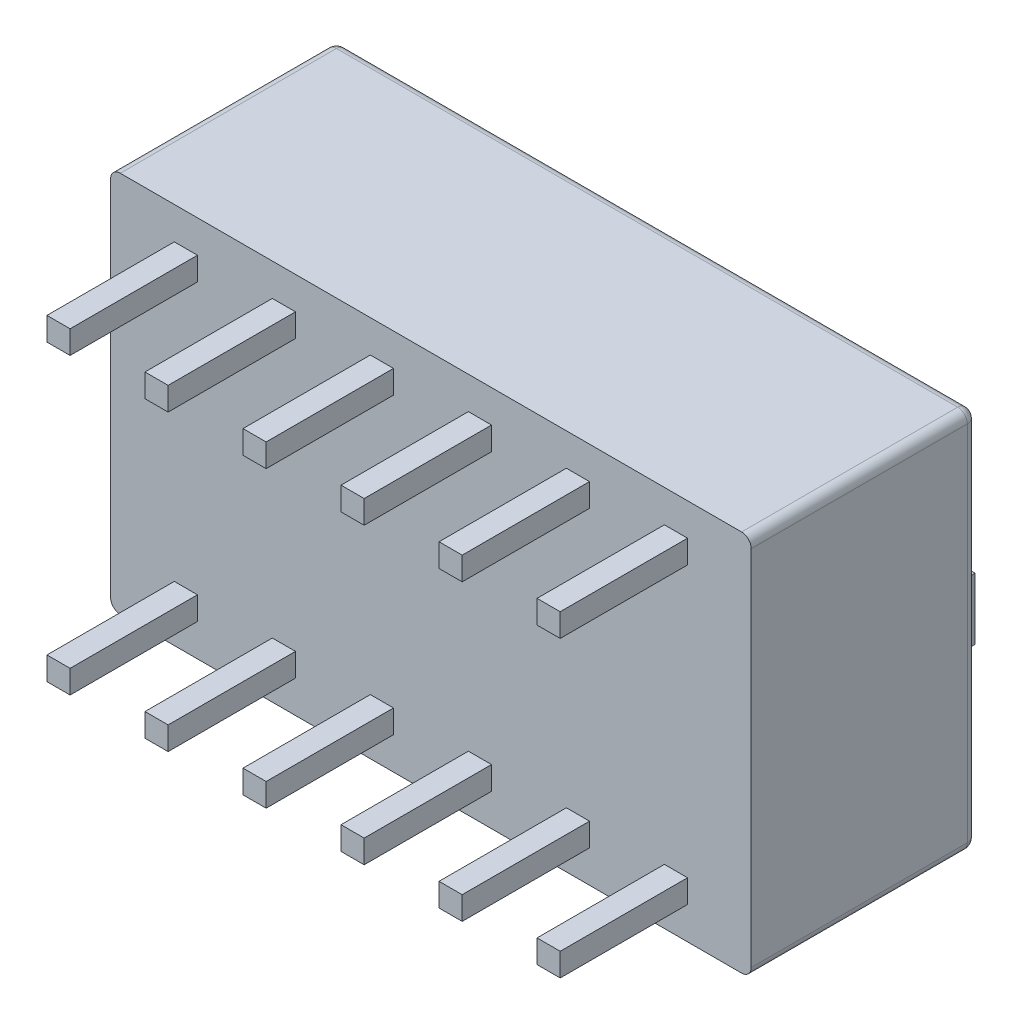
from build123d import *

# Parameters (mm, degrees)
IZIM1_W                       = 16.6
IZIM1_H                       = 9.9
Y_KSEKLIK_EKSTR_ZYON1_DEPTH   = 5.85
IZIM2_W                       = 1.4
IZIM2_H                       = 3.2
KES_EKSTR_ZYON1_DEPTH         = 1
IZIM3_W                       = 1.4
IZIM3_H                       = 1.6
Y_KSEKLIK_EKSTR_ZYON2_DEPTH   = 2.2
Y_KSEKLIK_EKSTR_ZYON2_2_DEPTH = 2.2
Y_KSEKLIK_EKSTR_ZYON2_3_DEPTH = 2.2
Y_KSEKLIK_EKSTR_ZYON2_4_DEPTH = 2.2
Y_KSEKLIK_EKSTR_ZYON2_5_DEPTH = 2.2
Y_KSEKLIK_EKSTR_ZYON2_6_DEPTH = 2.2
IZIM4_W                       = 1.4
IZIM4_H                       = 1.6
Y_KSEKLIK_EKSTR_ZYON3_DEPTH   = 0.9
Y_KSEKLIK_EKSTR_ZYON3_2_DEPTH = 0.9
Y_KSEKLIK_EKSTR_ZYON3_3_DEPTH = 0.9
Y_KSEKLIK_EKSTR_ZYON3_4_DEPTH = 0.9
Y_KSEKLIK_EKSTR_ZYON3_5_DEPTH = 0.9
Y_KSEKLIK_EKSTR_ZYON3_6_DEPTH = 0.9
RADYUS1_R                     = 0.25
IZIM5_W                       = 0.6
IZIM5_H                       = 0.6
Y_KSEKLIK_EKSTR_ZYON4_DEPTH   = 3.3


with BuildPart() as part:
    # Çizim1 → Yükseklik-Ekstrüzyon1 (new body)
    with BuildSketch(Plane.XY):
        Rectangle(IZIM1_W, IZIM1_H)
    extrude(amount=Y_KSEKLIK_EKSTR_ZYON1_DEPTH)

    # Çizim2 → Kes-Ekstrüzyon1 (cut)
    with BuildSketch(Plane(origin=(0, 0, 0), x_dir=(-1, 0, 0), z_dir=(0, 0, -1))):
        with Locations((-6.35, 0)):
            Rectangle(IZIM2_W, IZIM2_H)
        with Locations((-3.81, 0)):
            Rectangle(IZIM2_W, IZIM2_H)
        with Locations((-1.27, 0)):
            Rectangle(IZIM2_W, IZIM2_H)
        with Locations((1.27, 0)):
            Rectangle(IZIM2_W, IZIM2_H)
        with Locations((3.81, 0)):
            Rectangle(IZIM2_W, IZIM2_H)
        with Locations((6.35, 0)):
            Rectangle(IZIM2_W, IZIM2_H)
    extrude(amount=-KES_EKSTR_ZYON1_DEPTH, mode=Mode.SUBTRACT)

    # Radyus1
    radyus1_edges = [part.edges().sort_by_distance(p)[0] for p in [
        (0, -4.95, 0),
        (-8.3, 0, 0),
        (0, 4.95, 0),
        (8.3, 0, 0),
        (8.3, -4.95, 2.925),
        (-8.3, -4.95, 2.925),
        (-8.3, 4.95, 2.925),
        (8.3, 4.95, 2.925),
    ]]
    fillet(radyus1_edges, radius=RADYUS1_R)

    # Çizim5 → Yükseklik-Ekstrüzyon4 (add)
    with BuildSketch(Plane.XY.offset(5.85)):
        with Locations((-6.35, -3.81)):
            Rectangle(IZIM5_W, IZIM5_H)
        with Locations((-3.81, -3.81)):
            Rectangle(IZIM5_W, IZIM5_H)
        with Locations((-1.27, -3.81)):
            Rectangle(IZIM5_W, IZIM5_H)
        with Locations((1.27, -3.81)):
            Rectangle(IZIM5_W, IZIM5_H)
        with Locations((3.81, -3.81)):
            Rectangle(IZIM5_W, IZIM5_H)
        with Locations((6.35, -3.81)):
            Rectangle(IZIM5_W, IZIM5_H)
        with Locations((-6.35, 3.81)):
            Rectangle(IZIM5_W, IZIM5_H)
        with Locations((-3.81, 3.81)):
            Rectangle(IZIM5_W, IZIM5_H)
        with Locations((-1.27, 3.81)):
            Rectangle(IZIM5_W, IZIM5_H)
        with Locations((1.27, 3.81)):
            Rectangle(IZIM5_W, IZIM5_H)
        with Locations((3.81, 3.81)):
            Rectangle(IZIM5_W, IZIM5_H)
        with Locations((6.35, 3.81)):
            Rectangle(IZIM5_W, IZIM5_H)
    extrude(amount=Y_KSEKLIK_EKSTR_ZYON4_DEPTH)


with BuildPart() as body_2:
    # Çizim3 → Yükseklik-Ekstrüzyon2 (new body)
    with BuildSketch(Plane(origin=(0, 0, 1), x_dir=(-1, 0, 0), z_dir=(0, 0, -1))):
        with Locations((-6.35, -0.8)):
            Rectangle(IZIM3_W, IZIM3_H)
    extrude(amount=Y_KSEKLIK_EKSTR_ZYON2_DEPTH)


with BuildPart() as body_3:
    # Çizim3 → Y_kseklik-Ekstr_zyon2 2 (new body)
    with BuildSketch(Plane(origin=(0, 0, 1), x_dir=(-1, 0, 0), z_dir=(0, 0, -1))):
        with Locations((-3.81, -0.8)):
            Rectangle(IZIM3_W, IZIM3_H)
    extrude(amount=Y_KSEKLIK_EKSTR_ZYON2_2_DEPTH)


with BuildPart() as body_4:
    # Çizim3 → Y_kseklik-Ekstr_zyon2 3 (new body)
    with BuildSketch(Plane(origin=(0, 0, 1), x_dir=(-1, 0, 0), z_dir=(0, 0, -1))):
        with Locations((-1.27, -0.8)):
            Rectangle(IZIM3_W, IZIM3_H)
    extrude(amount=Y_KSEKLIK_EKSTR_ZYON2_3_DEPTH)


with BuildPart() as body_5:
    # Çizim3 → Y_kseklik-Ekstr_zyon2 4 (new body)
    with BuildSketch(Plane(origin=(0, 0, 1), x_dir=(-1, 0, 0), z_dir=(0, 0, -1))):
        with Locations((1.27, -0.8)):
            Rectangle(IZIM3_W, IZIM3_H)
    extrude(amount=Y_KSEKLIK_EKSTR_ZYON2_4_DEPTH)


with BuildPart() as body_6:
    # Çizim3 → Y_kseklik-Ekstr_zyon2 5 (new body)
    with BuildSketch(Plane(origin=(0, 0, 1), x_dir=(-1, 0, 0), z_dir=(0, 0, -1))):
        with Locations((3.81, -0.8)):
            Rectangle(IZIM3_W, IZIM3_H)
    extrude(amount=Y_KSEKLIK_EKSTR_ZYON2_5_DEPTH)


with BuildPart() as body_7:
    # Çizim3 → Y_kseklik-Ekstr_zyon2 6 (new body)
    with BuildSketch(Plane(origin=(0, 0, 1), x_dir=(-1, 0, 0), z_dir=(0, 0, -1))):
        with Locations((6.35, -0.8)):
            Rectangle(IZIM3_W, IZIM3_H)
    extrude(amount=Y_KSEKLIK_EKSTR_ZYON2_6_DEPTH)


with BuildPart() as body_8:
    # Çizim4 → Yükseklik-Ekstrüzyon3 (new body)
    with BuildSketch(Plane(origin=(0, 0, 1), x_dir=(-1, 0, 0), z_dir=(0, 0, -1))):
        with Locations((-6.35, 0.8)):
            Rectangle(IZIM4_W, IZIM4_H)
    extrude(amount=Y_KSEKLIK_EKSTR_ZYON3_DEPTH)


with BuildPart() as body_9:
    # Çizim4 → Y_kseklik-Ekstr_zyon3 2 (new body)
    with BuildSketch(Plane(origin=(0, 0, 1), x_dir=(-1, 0, 0), z_dir=(0, 0, -1))):
        with Locations((-3.81, 0.8)):
            Rectangle(IZIM4_W, IZIM4_H)
    extrude(amount=Y_KSEKLIK_EKSTR_ZYON3_2_DEPTH)


with BuildPart() as body_10:
    # Çizim4 → Y_kseklik-Ekstr_zyon3 3 (new body)
    with BuildSketch(Plane(origin=(0, 0, 1), x_dir=(-1, 0, 0), z_dir=(0, 0, -1))):
        with Locations((-1.27, 0.8)):
            Rectangle(IZIM4_W, IZIM4_H)
    extrude(amount=Y_KSEKLIK_EKSTR_ZYON3_3_DEPTH)


with BuildPart() as body_11:
    # Çizim4 → Y_kseklik-Ekstr_zyon3 4 (new body)
    with BuildSketch(Plane(origin=(0, 0, 1), x_dir=(-1, 0, 0), z_dir=(0, 0, -1))):
        with Locations((1.27, 0.8)):
            Rectangle(IZIM4_W, IZIM4_H)
    extrude(amount=Y_KSEKLIK_EKSTR_ZYON3_4_DEPTH)


with BuildPart() as body_12:
    # Çizim4 → Y_kseklik-Ekstr_zyon3 5 (new body)
    with BuildSketch(Plane(origin=(0, 0, 1), x_dir=(-1, 0, 0), z_dir=(0, 0, -1))):
        with Locations((3.81, 0.8)):
            Rectangle(IZIM4_W, IZIM4_H)
    extrude(amount=Y_KSEKLIK_EKSTR_ZYON3_5_DEPTH)


with BuildPart() as body_13:
    # Çizim4 → Y_kseklik-Ekstr_zyon3 6 (new body)
    with BuildSketch(Plane(origin=(0, 0, 1), x_dir=(-1, 0, 0), z_dir=(0, 0, -1))):
        with Locations((6.35, 0.8)):
            Rectangle(IZIM4_W, IZIM4_H)
    extrude(amount=Y_KSEKLIK_EKSTR_ZYON3_6_DEPTH)


solid = Compound([part.part, body_2.part, body_3.part, body_4.part, body_5.part, body_6.part, body_7.part, body_8.part, body_9.part, body_10.part, body_11.part, body_12.part, body_13.part])
